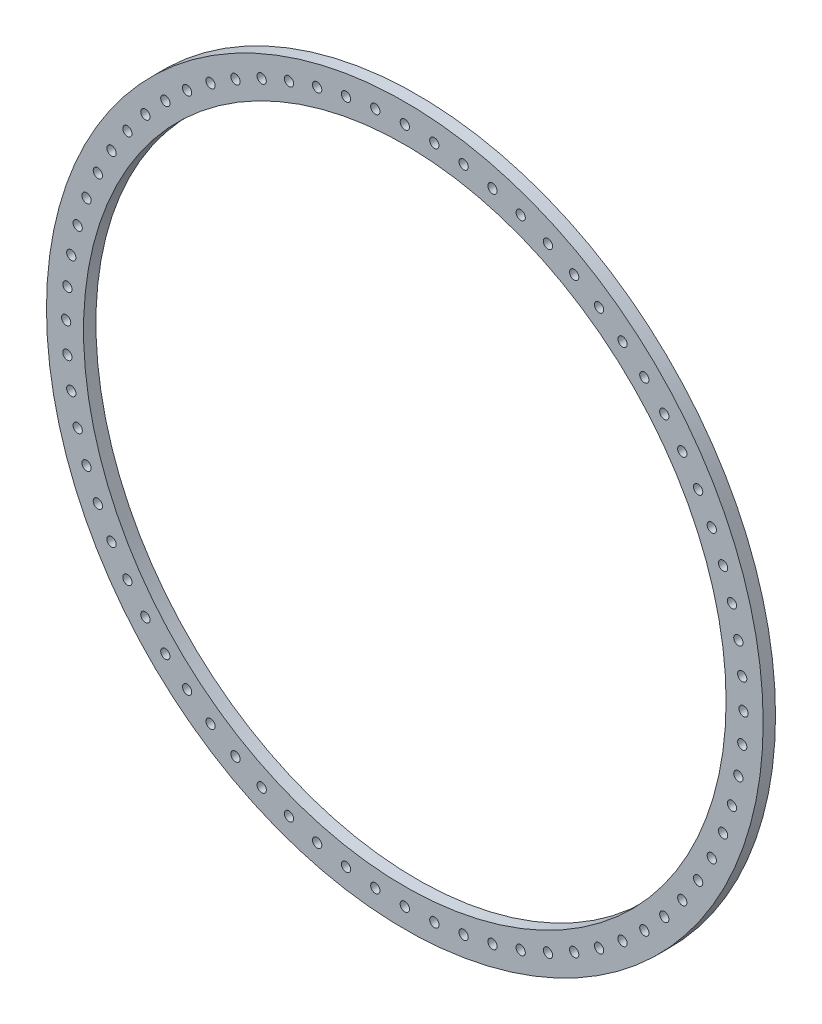
from build123d import *

# Parameters (mm, degrees)
SKETCH2_R           = 184.15
BOSS_EXTRUDE1_DEPTH = 6.35
SKETCH8_R           = 165.1
CUT_EXTRUDE3_DEPTH  = 261.504832009
SKETCH9_R           = 2.38125
CUT_EXTRUDE4_DEPTH  = 261.504832009
CIRPATTERN1_COUNT   = 72


with BuildPart() as part:
    # Sketch2 → Boss-Extrude1 (new body)
    with BuildSketch(Plane.XY):
        Circle(SKETCH2_R)
    extrude(amount=BOSS_EXTRUDE1_DEPTH)

    # Sketch8 → Cut-Extrude3 (cut, through all)
    with BuildSketch(Plane.XY.offset(6.35)):
        Circle(SKETCH8_R)
    extrude(amount=-CUT_EXTRUDE3_DEPTH, mode=Mode.SUBTRACT)

    # Sketch9 → Cut-Extrude4 (cut, through all)
    with BuildSketch(Plane.XY.offset(6.35)):
        with Locations((-174.049180881, 0)):
            Circle(SKETCH9_R)
    cut_extrude4 = extrude(amount=-CUT_EXTRUDE4_DEPTH, mode=Mode.SUBTRACT)

    # CirPattern1: Cut-Extrude4 ×72 about axis
    cirpattern1_axis = Axis((0, 0, 0), (0, 0, 1))
    for i in range(1, CIRPATTERN1_COUNT):
        add(cut_extrude4.rotate(cirpattern1_axis, i * 360 / CIRPATTERN1_COUNT), mode=Mode.SUBTRACT)


solid = part.part
